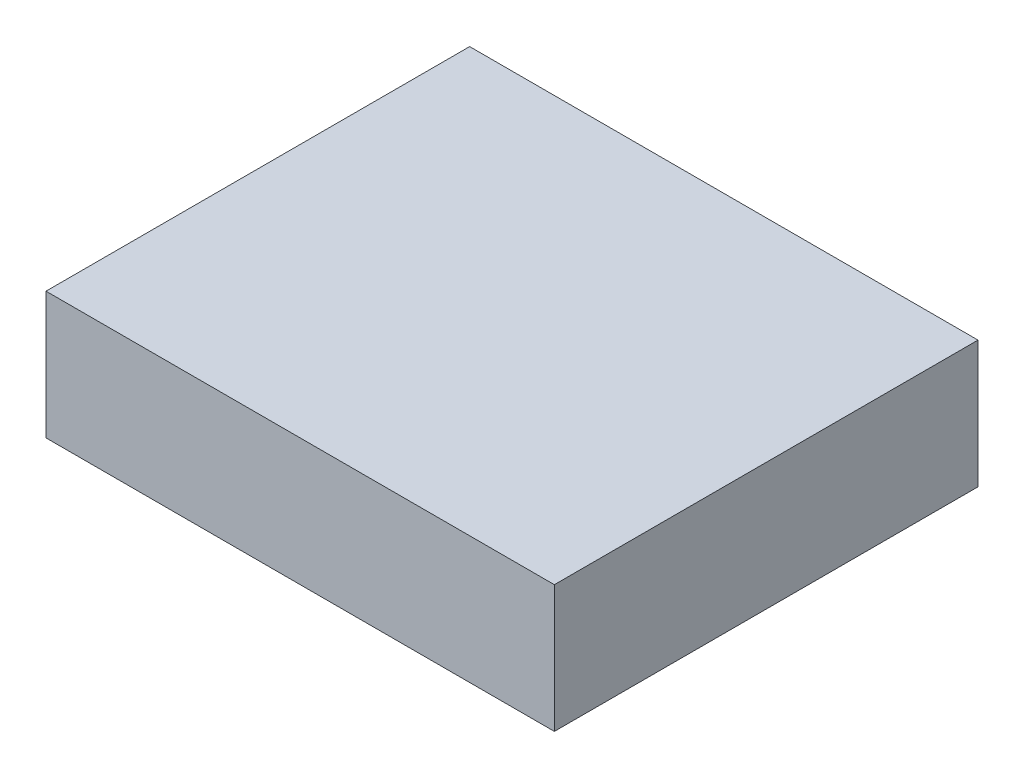
from build123d import *

# Parameters (mm, degrees)
BOSS_EXTRUDE2_DEPTH      = 60
BOSS_EXTRUDE2_DEPTH_BACK = 60
SKETCH1_W                = 30
SKETCH1_H                = 100


with BuildPart() as part:
    # Sketch1 → Boss-Extrude2 (new, two sides: drawn at the far end of the back side and taken through both)
    with BuildSketch(Plane.YZ.offset(-BOSS_EXTRUDE2_DEPTH_BACK)):
        with Locations((-465, -50)):
            Rectangle(SKETCH1_W, SKETCH1_H)
    extrude(amount=BOSS_EXTRUDE2_DEPTH + BOSS_EXTRUDE2_DEPTH_BACK)


solid = part.part
